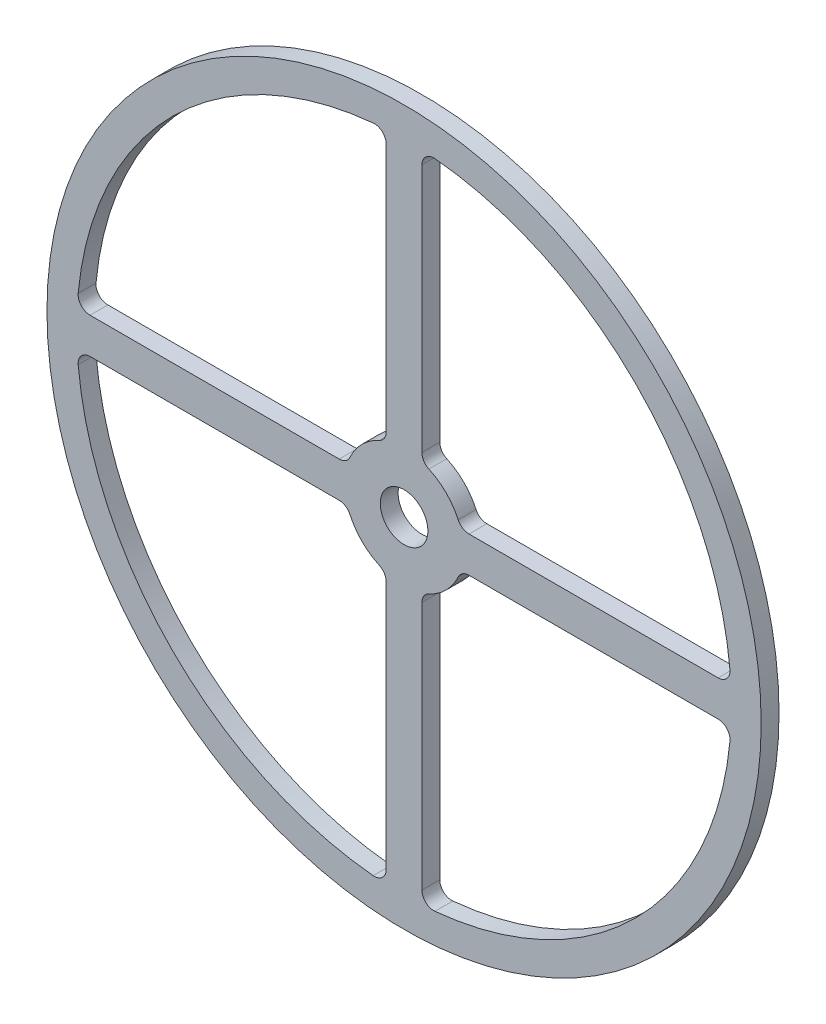
from build123d import *

# Parameters (mm, degrees)
SKETCH_1_R      = 60
SKETCH_1_R_2    = 4
EXTRUDE_1_DEPTH = 3
FILLET_1_R      = 2
FILLET_2_R      = 2
FILLET_4_R      = 2


with BuildPart() as part:
    # 草图1 → 凸台-拉伸1 (new body)
    with BuildSketch(Plane.XY):
        Circle(SKETCH_1_R)
        Circle(SKETCH_1_R_2, mode=Mode.SUBTRACT)
        with BuildLine():
            Line((3, 54.918120871), (3, 9.539392014))
            ThreePointArc((3, 9.539392014), (7.071067812, 7.071067812), (9.539392014, 3))
            Line((9.539392014, 3), (54.918120871, 3))
            ThreePointArc((54.918120871, 3), (38.890872965, 38.890872965), (3, 54.918120871))
        make_face(mode=Mode.SUBTRACT)
        with BuildLine():
            Line((-9.539392014, -3), (-54.918120871, -3))
            ThreePointArc((-54.918120871, -3), (-38.890872965, -38.890872965), (-3, -54.918120871))
            Line((-3, -54.918120871), (-3, -9.539392014))
            ThreePointArc((-3, -9.539392014), (-7.071067812, -7.071067812), (-9.539392014, -3))
        make_face(mode=Mode.SUBTRACT)
        with BuildLine():
            Line((9.539392014, -3), (54.918120871, -3))
            ThreePointArc((54.918120871, -3), (38.890872965, -38.890872965), (3, -54.918120871))
            Line((3, -54.918120871), (3, -9.539392014))
            ThreePointArc((3, -9.539392014), (7.071067812, -7.071067812), (9.539392014, -3))
        make_face(mode=Mode.SUBTRACT)
        with BuildLine():
            Line((-3, 9.539392014), (-3, 54.918120871))
            ThreePointArc((-3, 54.918120871), (-38.890872965, 38.890872965), (-54.918120871, 3))
            Line((-54.918120871, 3), (-9.539392014, 3))
            ThreePointArc((-9.539392014, 3), (-7.071067812, 7.071067812), (-3, 9.539392014))
        make_face(mode=Mode.SUBTRACT)
    extrude(amount=EXTRUDE_1_DEPTH)

    # 圆角1
    fillet_1_edges = [part.edges().sort_by_distance(p)[0] for p in [
        (3, 54.918120871, 1.5),
    ]]
    fillet(fillet_1_edges, radius=FILLET_1_R)

    # 圆角2
    fillet_2_edges = [part.edges().sort_by_distance(p)[0] for p in [
        (54.918120871, 3, 1.5),
        (3, -54.918120871, 1.5),
        (54.918120871, -3, 1.5),
        (-54.918120871, -3, 1.5),
        (-3, -54.918120871, 1.5),
        (-3, 54.918120871, 1.5),
        (-54.918120871, 3, 1.5),
    ]]
    fillet(fillet_2_edges, radius=FILLET_2_R)

    # 圆角4
    fillet_4_edges = [part.edges().sort_by_distance(p)[0] for p in [
        (3, 9.539392014, 1.5),
        (9.539392014, 3, 1.5),
        (9.539392014, -3, 1.5),
        (3, -9.539392014, 1.5),
        (-3, -9.539392014, 1.5),
        (-9.539392014, -3, 1.5),
        (-9.539392014, 3, 1.5),
        (-3, 9.539392014, 1.5),
    ]]
    fillet(fillet_4_edges, radius=FILLET_4_R)


solid = part.part
